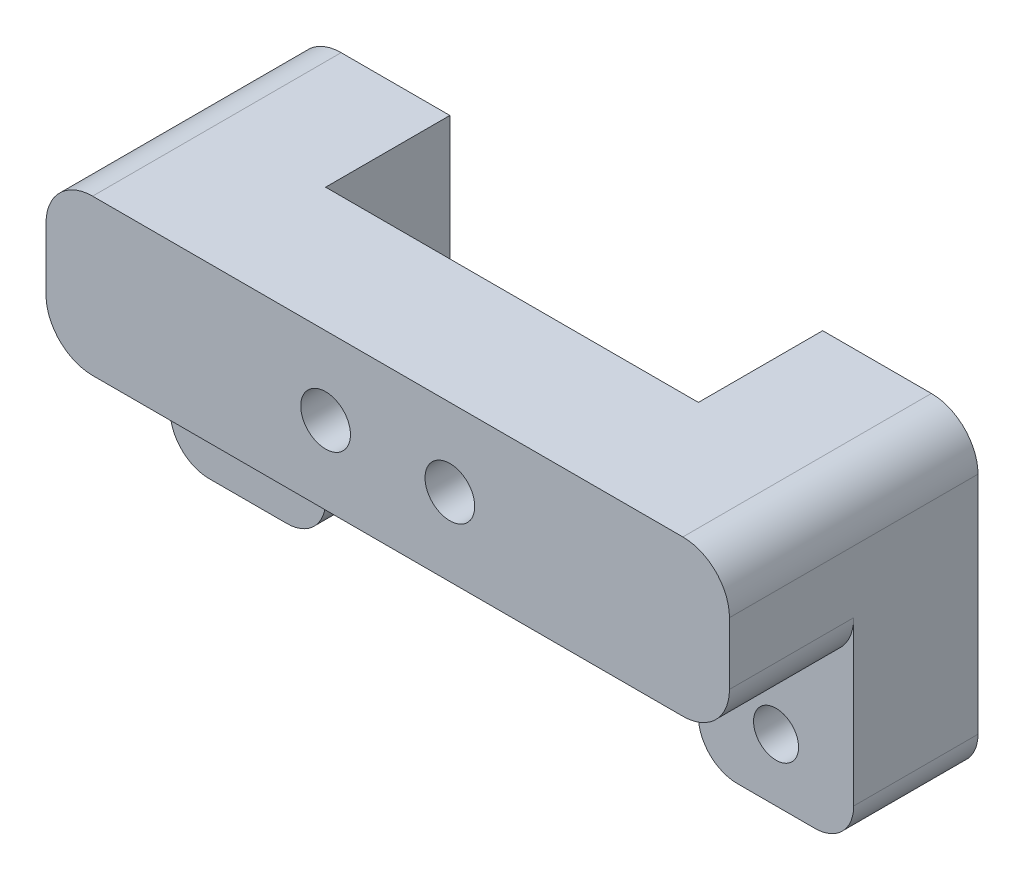
from build123d import *

# Parameters (mm, degrees)
SKETCH1_W           = 44
SKETCH1_H           = 10
BOSS_EXTRUDE1_DEPTH = 8
SKETCH4_W           = 10
SKETCH4_H           = 10
BOSS_EXTRUDE2_DEPTH = 8
SKETCH3_R           = 1.6
CUT_EXTRUDE2_DEPTH  = 48.874836814
SKETCH5_W           = 10
SKETCH5_H           = 8
BOSS_EXTRUDE3_DEPTH = 10
SKETCH6_R           = 1.45
CUT_EXTRUDE3_DEPTH  = 49.989794856
FILLET2_R           = 2.5
FILLET1_R           = 3


with BuildPart() as part:
    # Sketch1 → Boss-Extrude1 (new body)
    with BuildSketch(Plane.XY):
        with Locations((22, -5)):
            Rectangle(SKETCH1_W, SKETCH1_H)
    extrude(amount=BOSS_EXTRUDE1_DEPTH)

    # Sketch4 → Boss-Extrude2 (add)
    with BuildSketch(Plane(origin=(0, 0, 0), x_dir=(-1, 0, 0), z_dir=(0, 0, -1))):
        with Locations((-5, -5)):
            Rectangle(SKETCH4_W, SKETCH4_H)
        with Locations((-39, -5)):
            Rectangle(SKETCH4_W, SKETCH4_H)
    extrude(amount=BOSS_EXTRUDE2_DEPTH)

    # Sketch3 → Cut-Extrude2 (cut, through all)
    with BuildSketch(Plane.XY.offset(8)):
        with Locations((18, -5)):
            Circle(SKETCH3_R)
        with Locations((26, -5)):
            Circle(SKETCH3_R)
    extrude(amount=-CUT_EXTRUDE2_DEPTH, mode=Mode.SUBTRACT)

    # Sketch5 → Boss-Extrude3 (add)
    with BuildSketch(Plane(origin=(0, -10, 0), x_dir=(-1, 0, 0), z_dir=(0, -1, 0))):
        with Locations((-5, 4)):
            Rectangle(SKETCH5_W, SKETCH5_H)
        with Locations((-39, 4)):
            Rectangle(SKETCH5_W, SKETCH5_H)
    extrude(amount=BOSS_EXTRUDE3_DEPTH)

    # Sketch6 → Cut-Extrude3 (cut, through all)
    with BuildSketch(Plane.XY):
        with Locations((5, -16)):
            Circle(SKETCH6_R)
        with Locations((39, -16)):
            Circle(SKETCH6_R)
    extrude(amount=-CUT_EXTRUDE3_DEPTH, mode=Mode.SUBTRACT)

    # Fillet2
    fillet2_edges = [part.edges().sort_by_distance(p)[0] for p in [
        (10, -20, -4),
        (0, -20, -4),
        (34, -20, -4),
        (44, -20, -4),
    ]]
    fillet(fillet2_edges, radius=FILLET2_R)

    # Fillet1
    fillet1_edges = [part.edges().sort_by_distance(p)[0] for p in [
        (0, 0, 0),
        (44, 0, 0),
        (44, -10, 4),
        (0, -10, 4),
    ]]
    fillet(fillet1_edges, radius=FILLET1_R)


solid = part.part
